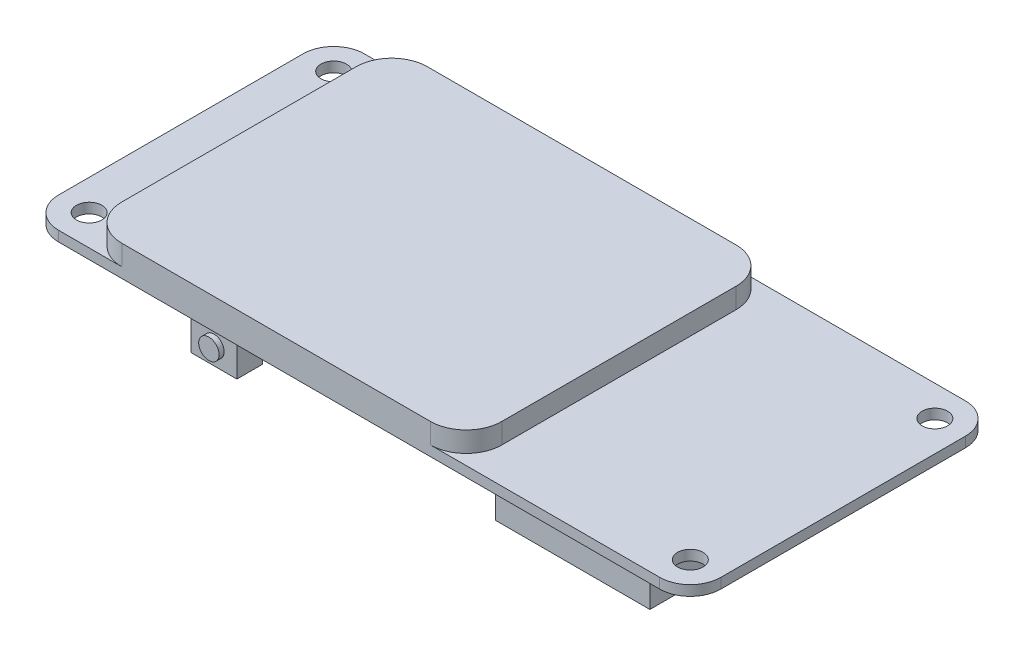
from build123d import *

# Parameters (mm, degrees)
SKETCH_1_R       = 1.25
BOARD_DEPTH      = 1
SKETCH_2_W       = 37.3
SKETCH_2_H       = 30
SCREEN_DEPTH     = 2
SCREEN_RADIUS_R  = 3.5
SKETCH_3_W       = 51
SKETCH_3_H       = 5
PLUG_DEPTH       = 7
SKETCH_4_W       = 15.14
SKETCH_4_H       = 20
SPEAKER_DEPTH    = 5
SKETCH_5_W       = 4.5
SKETCH_5_H       = 2.5
BUTTON_DEPTH     = 3.4
SKETCH_6_R       = 1
BUTTON_TAP_DEPTH = 0.5


with BuildPart() as part:
    # 草图1 → board (new body)
    with BuildSketch(Plane(origin=(0, 0, 0), x_dir=(1, 0, 0), z_dir=(0, 1, 0))):
        with BuildLine():
            Line((-29.5, 15), (29.5, 15))
            ThreePointArc((29.5, 15), (31.621320344, 14.121320344), (32.5, 12))
            Line((32.5, 12), (32.5, -12))
            ThreePointArc((32.5, -12), (31.621320344, -14.121320344), (29.5, -15))
            Line((29.5, -15), (-29.5, -15))
            ThreePointArc((-29.5, -15), (-31.621320344, -14.121320344), (-32.5, -12))
            Line((-32.5, -12), (-32.5, 12))
            ThreePointArc((-32.5, 12), (-31.621320344, 14.121320344), (-29.5, 15))
        make_face()
        with Locations(Location((-29.5, 12, 0), (0, 0, 270))):
            Circle(SKETCH_1_R, mode=Mode.SUBTRACT)
        with Locations(Location((29.5, 12, 0), (0, 0, 270))):
            Circle(SKETCH_1_R, mode=Mode.SUBTRACT)
        with Locations(Location((-29.5, -12, 0), (0, 0, 270))):
            Circle(SKETCH_1_R, mode=Mode.SUBTRACT)
        with Locations(Location((29.5, -12, 0), (0, 0, 270))):
            Circle(SKETCH_1_R, mode=Mode.SUBTRACT)
    extrude(amount=BOARD_DEPTH)

    # 草图2 → screen (add)
    with BuildSketch(Plane(origin=(0, 1, 0), x_dir=(1, 0, 0), z_dir=(0, 1, 0))):
        with Locations((-8.15, 0)):
            Rectangle(SKETCH_2_W, SKETCH_2_H)
    extrude(amount=SCREEN_DEPTH)

    # screen-radius
    screen_radius_edges = [part.edges().sort_by_distance(p)[0] for p in [
        (-26.8, 2, -15),
        (-26.8, 2, 15),
        (10.5, 2, 15),
        (10.5, 2, -15),
    ]]
    fillet(screen_radius_edges, radius=SCREEN_RADIUS_R)

    # 草图3 → plug (add)
    with BuildSketch(Plane.XZ):
        with Locations((0, -11.5)):
            Rectangle(SKETCH_3_W, SKETCH_3_H)
    extrude(amount=PLUG_DEPTH)

    # 草图4 → speaker (add)
    with BuildSketch(Plane.XZ):
        with Locations((18.18, 2.216190629)):
            Rectangle(SKETCH_4_W, SKETCH_4_H)
    extrude(amount=SPEAKER_DEPTH)

    # 草图5 → button (add)
    with BuildSketch(Plane.XZ):
        with Locations((-14.75, 13.25)):
            Rectangle(SKETCH_5_W, SKETCH_5_H)
    extrude(amount=BUTTON_DEPTH)

    # 草图6 → button-tap (add)
    with BuildSketch(Plane.XY.offset(14.5)):
        with Locations(Location((-14.75, -1.7, 0), (0, 0, 180))):
            Circle(SKETCH_6_R)
    extrude(amount=BUTTON_TAP_DEPTH)


solid = part.part
